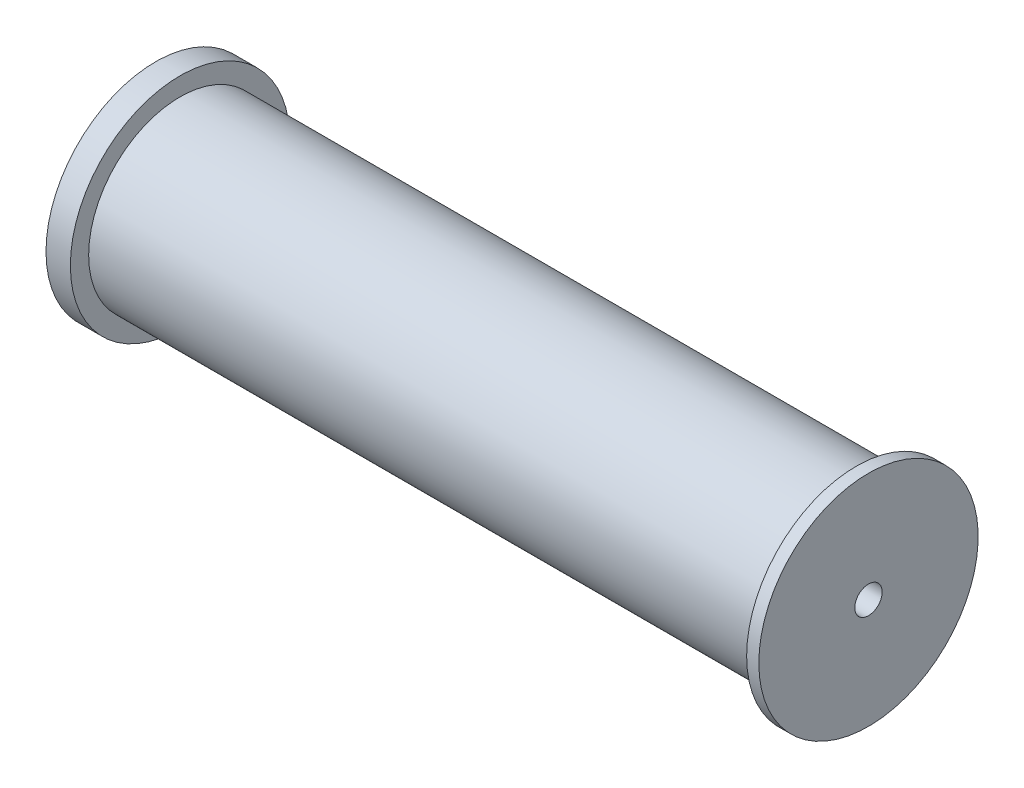
from build123d import *

# Parameters (mm, degrees)
ESQUISSE4_R             = 2.25
ENL_V_MAT_EXTRU_2_DEPTH = 120.737212261


with BuildPart() as part:
    # Esquisse2 → Révolution1 (revolve)
    with BuildSketch(Plane.XY, mode=Mode.PRIVATE) as r_volution1_sk:
        Polygon((4, 18), (0, 18), (0, 0), (117, 0), (117, 18), (115, 18), (115, 15), (4, 15), align=None)
    revolve(r_volution1_sk.sketch.rotate(Axis((-23.43828007, 0, 0), (1, 0, 0)), 90), axis=Axis((-23.43828007, 0, 0), (1, 0, 0)))

    # Esquisse4 → Enlèv. mat.-Extru.2 (cut, through all)
    with BuildSketch(Plane.ZY):
        Circle(ESQUISSE4_R)
    extrude(amount=-ENL_V_MAT_EXTRU_2_DEPTH, mode=Mode.SUBTRACT)


solid = part.part
